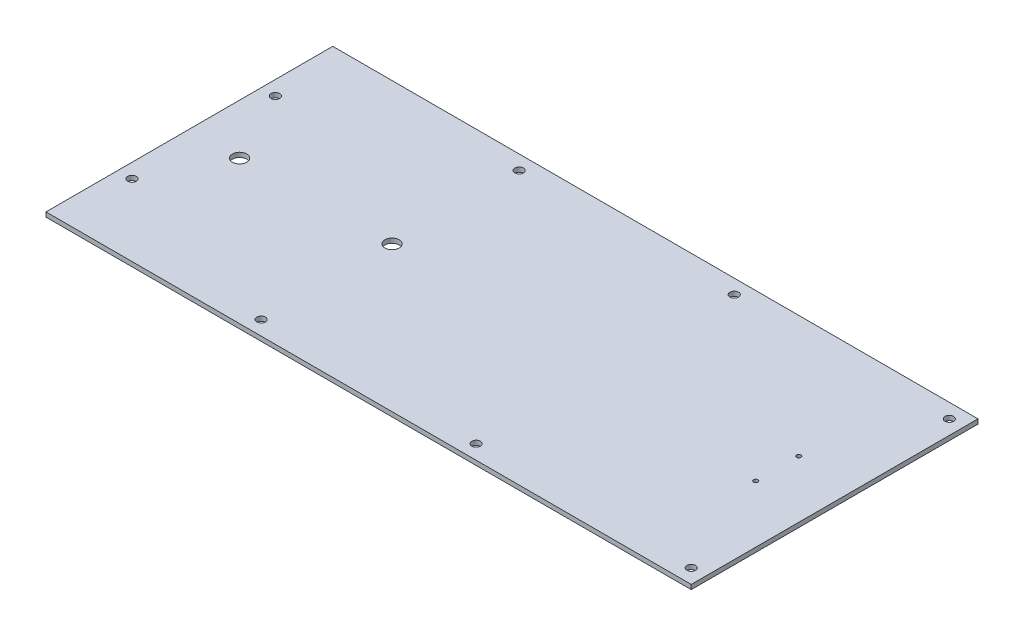
from build123d import *

# Parameters (mm, degrees)
SKETCH1_R           = 1.5
SKETCH1_R_2         = 3
SKETCH1_R_3         = 5
BOSS_EXTRUDE1_DEPTH = 3.175


with BuildPart() as part:
    # Sketch1 → Boss-Extrude1 (new body)
    with BuildSketch(Plane(origin=(0, 0, 0), x_dir=(1, 0, 0), z_dir=(0, 1, 0))):
        Polygon((70, 110.468098835), (450, 110.468098835), (450, 310.468098835), (70, 310.468098835), (0, 310.468098835), (0, 110.468098835), align=None)
        with Locations(Location((410, 225.468098835, 0), (0, 0, 270))):
            Circle(SKETCH1_R, mode=Mode.SUBTRACT)
        with Locations(Location((410, 195.468098835, 0), (0, 0, 270))):
            Circle(SKETCH1_R, mode=Mode.SUBTRACT)
        with Locations(Location((10, 260.468098835, 0), (0, 0, 270))):
            Circle(SKETCH1_R_2, mode=Mode.SUBTRACT)
        with Locations(Location((440, 300.468098835, 0), (0, 0, 270))):
            Circle(SKETCH1_R_2, mode=Mode.SUBTRACT)
        with Locations(Location((140, 300.468098835, 0), (0, 0, 270))):
            Circle(SKETCH1_R_2, mode=Mode.SUBTRACT)
        with Locations(Location((290, 300.468098835, 0), (0, 0, 270))):
            Circle(SKETCH1_R_2, mode=Mode.SUBTRACT)
        with Locations(Location((440, 120.468098835, 0), (0, 0, 90))):
            Circle(SKETCH1_R_2, mode=Mode.SUBTRACT)
        with Locations(Location((290, 120.468098835, 0), (0, 0, 90))):
            Circle(SKETCH1_R_2, mode=Mode.SUBTRACT)
        with Locations(Location((140, 120.468098835, 0), (0, 0, 90))):
            Circle(SKETCH1_R_2, mode=Mode.SUBTRACT)
        with Locations(Location((10, 160.468098835, 0), (0, 0, 90))):
            Circle(SKETCH1_R_2, mode=Mode.SUBTRACT)
        with Locations(Location((35, 210.468098835, 0), (0, 0, 270))):
            Circle(SKETCH1_R_3, mode=Mode.SUBTRACT)
        with Locations(Location((140, 211.808399399, 0), (0, 0, 270))):
            Circle(SKETCH1_R_3, mode=Mode.SUBTRACT)
    extrude(amount=BOSS_EXTRUDE1_DEPTH)


solid = part.part
